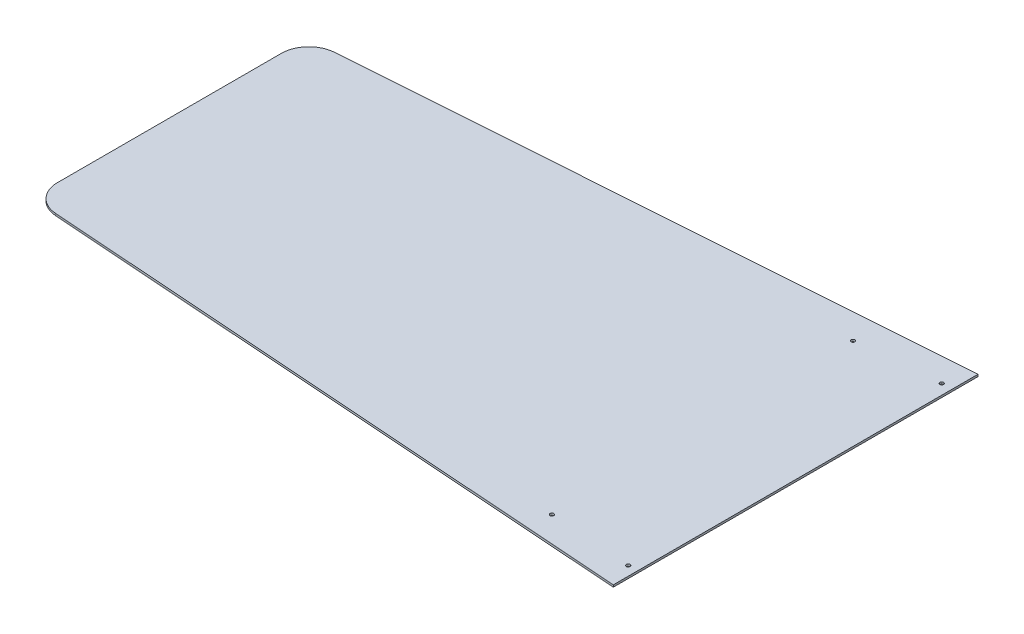
from build123d import *

# Parameters (mm, degrees)
RESSALTO_EXTRUS_O1_DEPTH = 3
SKETCH1_R                = 2.75
CUT_EXTRUDE1_DEPTH       = 10


with BuildPart() as part:
    # Esboço1 → Ressalto-extrusão1 (new body)
    with BuildSketch(Plane(origin=(0, 0, 0), x_dir=(1, 0, 0), z_dir=(0, 1, 0))):
        with BuildLine():
            Line((0, 162.755231864), (0, -162.755231864))
            ThreePointArc((0, -162.755231864), (10.725477972, -190.013301495), (37.150118, -202.653579857))
            Line((37.150118, -202.653579857), (910, -265))
            Line((910, -265), (910, 265))
            Line((910, 265), (37.150118, 202.653579857))
            ThreePointArc((37.150118, 202.653579857), (10.725477972, 190.013301495), (0, 162.755231864))
        make_face()
    extrude(amount=RESSALTO_EXTRUS_O1_DEPTH)

    # Sketch1 → Cut-Extrude1 (cut)
    with BuildSketch(Plane(origin=(0, 3, 0), x_dir=(1, 0, 0), z_dir=(0, 1, 0))):
        with Locations(Location((776.99864992, -221.137424035, 0), (0, 0, 270))):
            Circle(SKETCH1_R)
        with Locations(Location((896.405474423, -229.771178815, 0), (0, 0, 270))):
            Circle(SKETCH1_R)
        with Locations(Location((776.99864992, 216.259876239, 0), (0, 0, 270))):
            Circle(SKETCH1_R)
        with Locations(Location((895.061762745, 227.273960295, 0), (0, 0, 270))):
            Circle(SKETCH1_R)
    extrude(amount=-CUT_EXTRUDE1_DEPTH, mode=Mode.SUBTRACT)


solid = part.part
